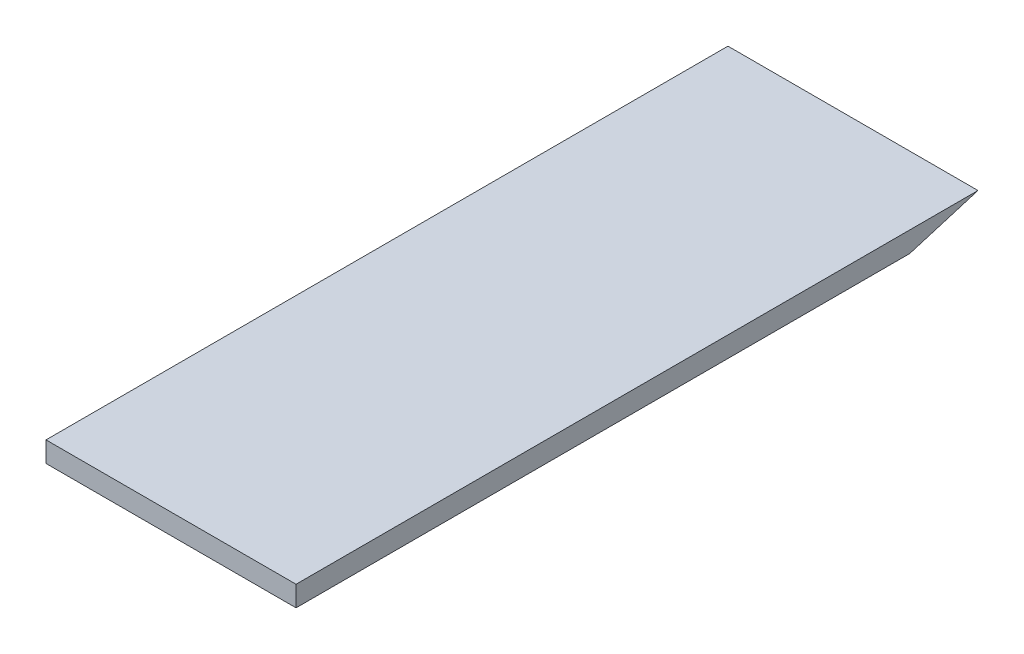
from build123d import *

# Parameters (mm, degrees)
BOSS_EXTRUDE1_DEPTH = 110


with BuildPart() as part:
    # Sketch1 → Boss-Extrude1 (new body)
    with BuildSketch(Plane(origin=(0, 0, 0), x_dir=(0, 0, -1), z_dir=(1, 0, 0))):
        Polygon((0, 9), (0, 0), (270, 0), (300, 9), align=None)
    extrude(amount=BOSS_EXTRUDE1_DEPTH)


solid = part.part
